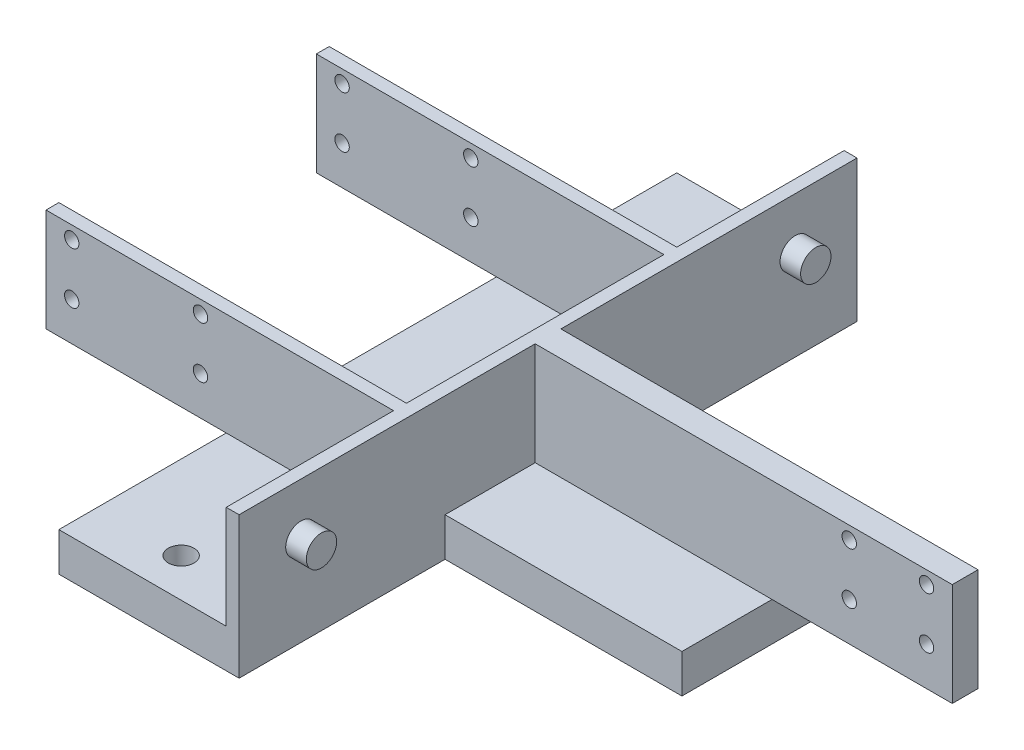
from build123d import *

# Parameters (mm, degrees)
SKETCH1_W           = 35
SKETCH1_H           = 120
SKETCH1_W_2         = 46
SKETCH1_H_2         = 40
BOSS_EXTRUDE1_DEPTH = 7.5
BOSS_EXTRUDE2_DEPTH = 20
SKETCH3_R           = 1.4
CUT_EXTRUDE1_DEPTH  = 5
SKETCH5_R           = 2.95
BOSS_EXTRUDE4_DEPTH = 4
SKETCH6_R           = 1.4
CUT_EXTRUDE2_DEPTH  = 60
SKETCH7_R           = 2.5
CUT_EXTRUDE3_DEPTH  = 10


with BuildPart() as part:
    # Sketch1 → Boss-Extrude1 (new body)
    with BuildSketch(Plane(origin=(0, 0, 0), x_dir=(1, 0, 0), z_dir=(0, 1, 0))):
        with Locations((17.5, 0)):
            Rectangle(SKETCH1_W, SKETCH1_H)
        with Locations((58, 0)):
            Rectangle(SKETCH1_W_2, SKETCH1_H_2)
    extrude(amount=BOSS_EXTRUDE1_DEPTH)

    # Sketch2 → Boss-Extrude2 (add)
    with BuildSketch(Plane(origin=(0, 7.5, 0), x_dir=(1, 0, 0), z_dir=(0, 1, 0))):
        Polygon((35, 2.5), (35, 60), (32.5, 60), (32.5, 27.5), (-35, 27.5), (-35, 25), (32.5, 25), (32.5, -25), (-35, -25), (-35, -27.5), (32.5, -27.5), (32.5, -60), (35, -60), (35, -2.5), (116, -2.5), (116, 2.5), align=None)
    extrude(amount=BOSS_EXTRUDE2_DEPTH)

    # Sketch3 → Cut-Extrude1 (cut)
    with BuildSketch(Plane.XY.offset(2.5)):
        with Locations((111, 25)):
            Circle(SKETCH3_R)
        with Locations((111, 15)):
            Circle(SKETCH3_R)
        with Locations((96, 15)):
            Circle(SKETCH3_R)
        with Locations((96, 25)):
            Circle(SKETCH3_R)
    extrude(amount=-CUT_EXTRUDE1_DEPTH, mode=Mode.SUBTRACT)

    # Sketch5 → Boss-Extrude4 (add)
    with BuildSketch(Plane(origin=(35, 0, 0), x_dir=(0, 0, -1), z_dir=(1, 0, 0))):
        with Locations((-48, 17.5)):
            Circle(SKETCH5_R)
        with Locations(Location((48, 17.5, 0), (0, 0, 180))):
            Circle(SKETCH5_R)
    extrude(amount=BOSS_EXTRUDE4_DEPTH)

    # Sketch6 → Cut-Extrude2 (cut)
    with BuildSketch(Plane.XY.offset(27.5)):
        with Locations((-30, 25)):
            Circle(SKETCH6_R)
        with Locations((-5, 25)):
            Circle(SKETCH6_R)
        with Locations((-30, 15)):
            Circle(SKETCH6_R)
        with Locations((-5, 15)):
            Circle(SKETCH6_R)
    extrude(amount=-CUT_EXTRUDE2_DEPTH, mode=Mode.SUBTRACT)

    # Sketch7 → Cut-Extrude3 (cut)
    with BuildSketch(Plane(origin=(0, 7.5, 0), x_dir=(1, 0, 0), z_dir=(0, 1, 0))):
        with Locations(Location((16.25, 52.5, 0), (0, 0, 270))):
            Circle(SKETCH7_R)
        with Locations(Location((16.25, 35, 0), (0, 0, 270))):
            Circle(SKETCH7_R)
        with Locations(Location((16.25, -35, 0), (0, 0, 270))):
            Circle(SKETCH7_R)
        with Locations(Location((16.25, -52.5, 0), (0, 0, 270))):
            Circle(SKETCH7_R)
    extrude(amount=-CUT_EXTRUDE3_DEPTH, mode=Mode.SUBTRACT)


solid = part.part
